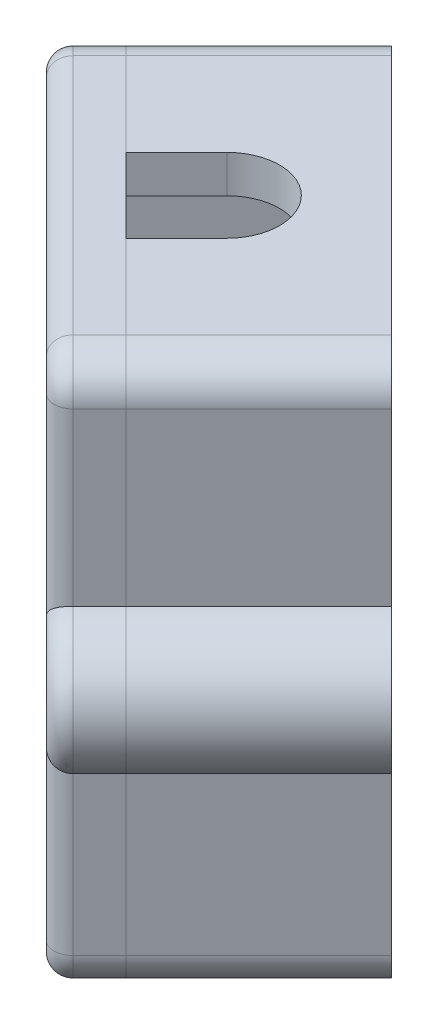
from build123d import *

# Parameters (mm, degrees)
BOSS_EXTRUDE1_DEPTH = 10
CUT_EXTRUDE1_REACH  = 66.268
SKETCH2_R           = 1.125
SKETCH3_W           = 18.2
SKETCH3_H           = 25.2
CUT_EXTRUDE2_DEPTH  = 8
CUT_EXTRUDE3_REACH  = 133.093
SKETCH5_R           = 1.25
SKETCH5_W           = 10
SKETCH5_H           = 5
BOSS_EXTRUDE2_DEPTH = 3
FILLET1_R           = 1


with BuildPart() as part:
    # Sketch1 → Boss-Extrude1 (new body)
    with BuildSketch(Plane(origin=(-69.394235316, 0, 69.394235316), x_dir=(0.7071067811865521, 0, 0.707106781186543), z_dir=(-0.707106781186543, 0, 0.7071067811865521))):
        with BuildLine():
            Line((-47.051825189, 20.998571137), (-47.051825189, 30.1))
            ThreePointArc((-47.051825189, 30.1), (-46.466038752, 31.514213562), (-45.051825189, 32.1))
            Line((-45.051825189, 32.1), (-26.851825189, 32.1))
            ThreePointArc((-26.851825189, 32.1), (-25.437611627, 31.514213562), (-24.851825189, 30.1))
            Line((-24.851825189, 30.1), (-24.851825189, 20.998571137))
            ThreePointArc((-24.851825189, 20.998571137), (-21.451825189, 17.5), (-24.851825189, 14.001428863))
            Line((-24.851825189, 14.001428863), (-24.851825189, 4.9))
            ThreePointArc((-24.851825189, 4.9), (-25.437611627, 3.485786438), (-26.851825189, 2.9))
            Line((-26.851825189, 2.9), (-45.051825189, 2.9))
            ThreePointArc((-45.051825189, 2.9), (-46.466038752, 3.485786438), (-47.051825189, 4.9))
            Line((-47.051825189, 4.9), (-47.051825189, 14.001428863))
            ThreePointArc((-47.051825189, 14.001428863), (-50.451825189, 17.5), (-47.051825189, 20.998571137))
        make_face()
    extrude(amount=BOSS_EXTRUDE1_DEPTH)

    # Sketch2 → Cut-Extrude1 (cut, up to next)
    with BuildSketch(Plane(origin=(-76.465303128, 0, 76.465303128), x_dir=(0.707106781186552, 0, 0.707106781186543), z_dir=(-0.707106781186543, 0, 0.707106781186552)), mode=Mode.PRIVATE) as cut_extrude1_sk1:
        with Locations((-46.951825189, 17.5)):
            Circle(SKETCH2_R)
    cut_extrude1_tool1 = extrude(cut_extrude1_sk1.sketch, amount=-CUT_EXTRUDE1_REACH, mode=Mode.PRIVATE) & part.part
    # Sketch2 → Cut-Extrude1 (cut, up to next)
    with BuildSketch(Plane(origin=(-76.465303128, 0, 76.465303128), x_dir=(0.707106781186552, 0, 0.707106781186543), z_dir=(-0.707106781186543, 0, 0.707106781186552)), mode=Mode.PRIVATE) as cut_extrude1_sk2:
        with Locations((-24.951825189, 17.5)):
            Circle(SKETCH2_R)
    cut_extrude1_tool2 = extrude(cut_extrude1_sk2.sketch, amount=-CUT_EXTRUDE1_REACH, mode=Mode.PRIVATE) & part.part
    add(cut_extrude1_tool1.solids().sort_by_distance((-109.665257, 17.5, 43.265349))[0], mode=Mode.SUBTRACT)
    add(cut_extrude1_tool2.solids().sort_by_distance((-94.108908, 17.5, 58.821698))[0], mode=Mode.SUBTRACT)

    # Sketch3 → Cut-Extrude2 (cut)
    with BuildSketch(Plane(origin=(-76.465303128, 0, 76.465303128), x_dir=(0.707106781186552, 0, 0.707106781186543), z_dir=(-0.707106781186543, 0, 0.707106781186552))):
        with Locations((-35.951825189, 17.5)):
            Rectangle(SKETCH3_W, SKETCH3_H)
    extrude(amount=-CUT_EXTRUDE2_DEPTH, mode=Mode.SUBTRACT)

    # Sketch4 → Cut-Extrude3 (cut, up to next)
    with BuildSketch(Plane(origin=(0, 32.1, 0), x_dir=(1, 0, 0), z_dir=(0, 1, 0)), mode=Mode.PRIVATE) as cut_extrude3_sk1:
        with BuildLine():
            Line((-103.866981503, -49.063624754), (-101.179975734, -46.376618985))
            ThreePointArc((-101.179975734, -46.376618985), (-97.22017776, -46.376618985), (-97.22017776, -50.33641696))
            Line((-97.22017776, -50.33641696), (-99.907183528, -53.023422728))
            Line((-99.907183528, -53.023422728), (-103.866981503, -49.063624754))
        make_face()
    cut_extrude3_tool1 = extrude(cut_extrude3_sk1.sketch, amount=-CUT_EXTRUDE3_REACH, mode=Mode.PRIVATE) & part.part
    add(cut_extrude3_tool1.solids().sort_by_distance((-99.743058, 32.1, 48.899499))[0], mode=Mode.SUBTRACT)


with BuildPart() as body_2:
    # Sketch5 → Boss-Extrude2 (new body)
    with BuildSketch(Plane(origin=(-76.465303128, 0, 76.465303128), x_dir=(0.707106781186552, 0, 0.707106781186543), z_dir=(-0.707106781186543, 0, 0.707106781186552))):
        with BuildLine():
            Line((-47.051825189, 20.998571137), (-47.051825189, 30.1))
            ThreePointArc((-47.051825189, 30.1), (-46.466038752, 31.514213562), (-45.051825189, 32.1))
            Line((-45.051825189, 32.1), (-26.851825189, 32.1))
            ThreePointArc((-26.851825189, 32.1), (-25.437611627, 31.514213562), (-24.851825189, 30.1))
            Line((-24.851825189, 30.1), (-24.851825189, 20.998571137))
            ThreePointArc((-24.851825189, 20.998571137), (-21.451825189, 17.5), (-24.851825189, 14.001428863))
            Line((-24.851825189, 14.001428863), (-24.851825189, 4.9))
            ThreePointArc((-24.851825189, 4.9), (-25.437611627, 3.485786438), (-26.851825189, 2.9))
            Line((-26.851825189, 2.9), (-45.051825189, 2.9))
            ThreePointArc((-45.051825189, 2.9), (-46.466038752, 3.485786438), (-47.051825189, 4.9))
            Line((-47.051825189, 4.9), (-47.051825189, 14.001428863))
            ThreePointArc((-47.051825189, 14.001428863), (-50.451825189, 17.5), (-47.051825189, 20.998571137))
        make_face()
        with Locations((-46.951825189, 17.5)):
            Circle(SKETCH5_R, mode=Mode.SUBTRACT)
        with Locations(Location((-24.951825189, 17.5, 0), (0, 0, 180))):
            Circle(SKETCH5_R, mode=Mode.SUBTRACT)
        with Locations((-35.951825189, 7.4)):
            Rectangle(SKETCH5_W, SKETCH5_H, mode=Mode.SUBTRACT)
    extrude(amount=BOSS_EXTRUDE2_DEPTH)

    # Fillet1
    fillet1_edges = [body_2.edges().sort_by_distance(p)[0] for p in [
        (-111.443074568, 3.485786438, 45.730172376),
        (-104.008402859, 2.9, 53.164844084),
        (-96.57373115, 3.485786438, 60.599515793),
        (-96.159517588, 9.450714432, 61.013729356),
        (-93.755354532, 17.5, 63.417892412),
        (-96.159517588, 25.549285568, 61.013729356),
        (-96.57373115, 31.514213562, 60.599515793),
        (-104.008402859, 32.1, 53.164844084),
        (-111.443074568, 31.514213562, 45.730172376),
        (-111.85728813, 25.549285568, 45.315958813),
        (-114.261451186, 17.5, 42.911795757),
        (-111.85728813, 9.450714432, 45.315958813),
    ]]
    fillet(fillet1_edges, radius=FILLET1_R)


solid = Compound([part.part, body_2.part])
